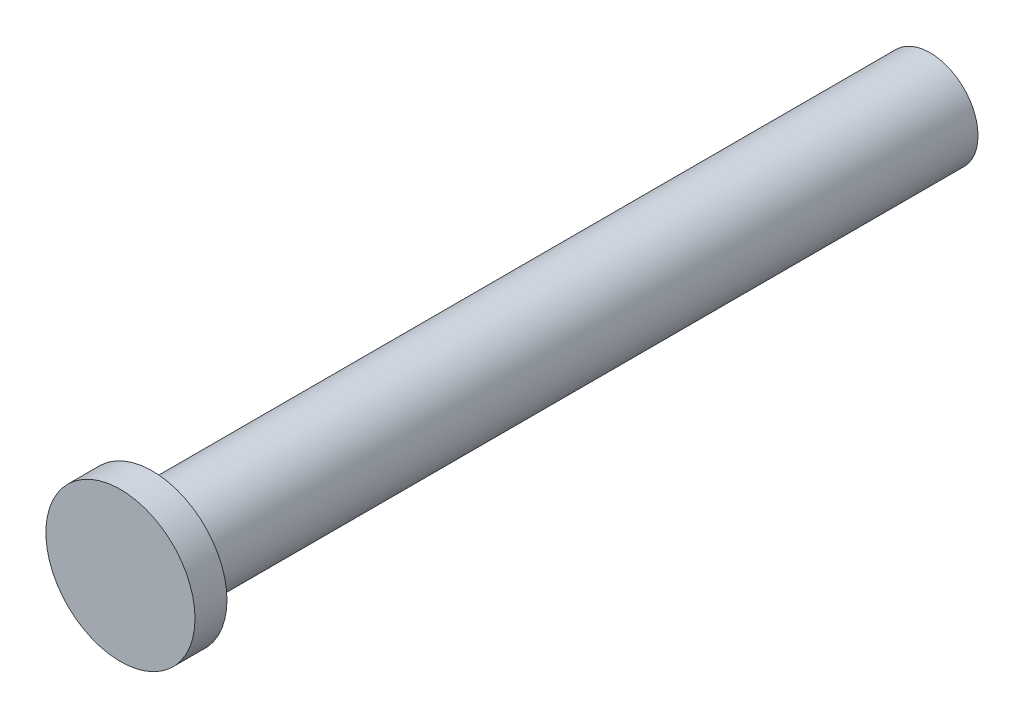
from build123d import *


with BuildPart() as part:
    # Sketch1 → Revolve1 (revolve)
    with BuildSketch(Plane.YZ, mode=Mode.PRIVATE) as revolve1_sk:
        Polygon((0, 219.133333333), (35, 219.133333333), (35, 204.133333333), (22.5, 204.133333333), (22.5, -160.866666667), (0, -160.866666667), align=None)
    revolve(revolve1_sk.sketch.rotate(Axis((0, 0, 219.133333333), (0, 0, -1)), 90), axis=Axis((0, 0, 219.133333333), (0, 0, -1)))


solid = part.part
